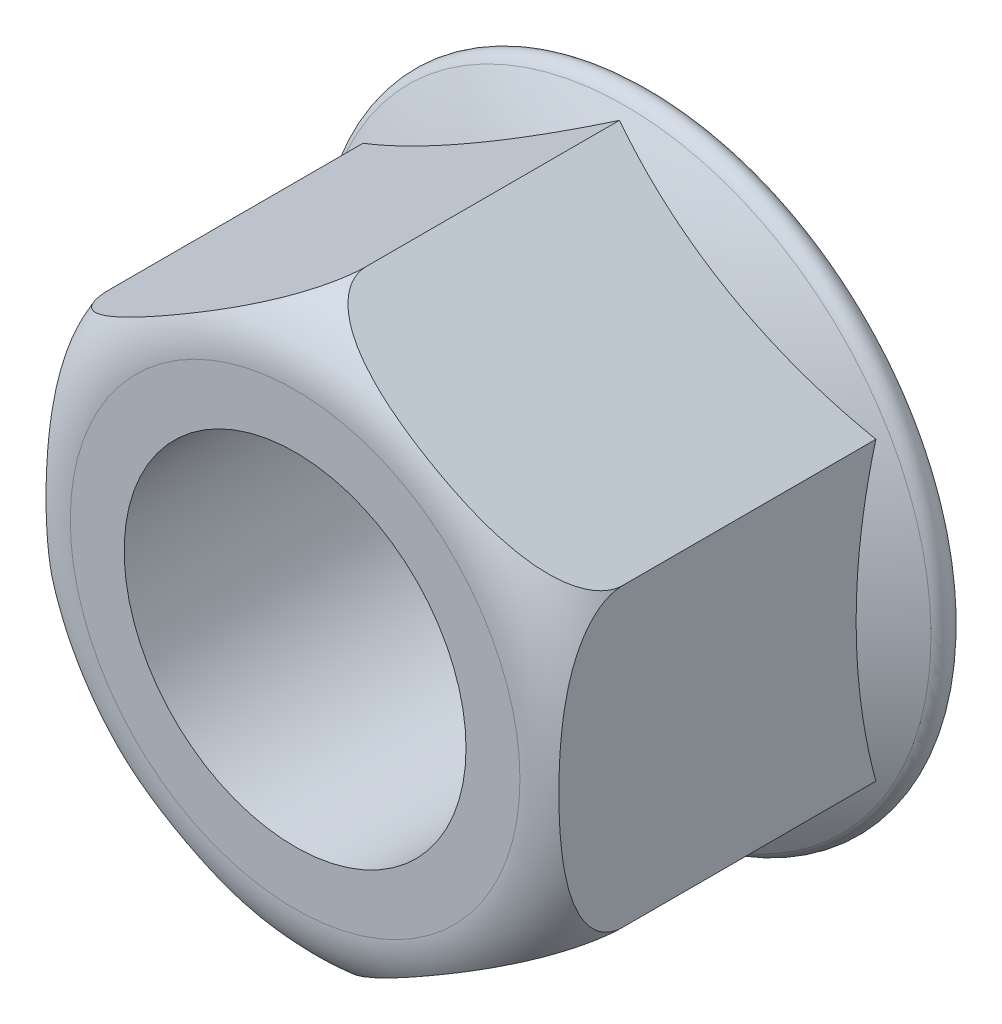
from build123d import *

# Parameters (mm, degrees)
HEAD_DEPTH         = 12.7
HOLE_SKETCH_R      = 6.096
THROUGH_HOLE_DEPTH = 21.266683312


with BuildPart() as part:
    # Head Sketch → Head (new body)
    with BuildSketch(Plane.XY):
        Polygon((0, 10.558581723), (9.144, 5.279290861), (9.144, -5.279290861), (0, -10.558581723), (-9.144, -5.279290861), (-9.144, 5.279290861), align=None)
    extrude(amount=HEAD_DEPTH)

    # Flange Sketch → Flange (revolve)
    with BuildSketch(Plane(origin=(0, 0, 0), x_dir=(-1, 0, 0), z_dir=(0, 1, 0)), mode=Mode.PRIVATE) as flange_sk:
        with BuildLine():
            Line((-10.668, 0), (0, 0))
            Line((0, 0), (0, 3.81))
            ThreePointArc((0, 3.81), (-5.643297007, 3.079227926), (-10.91431477, 0.935119563))
            ThreePointArc((-10.91431477, 0.935119563), (-11.151507901, 0.372641807), (-10.668, 0))
        make_face()
    revolve(flange_sk.sketch.rotate(Axis((0, 0, 1.843425858), (0, 0, 1)), 30), axis=Axis((0, 0, 1.843425858), (0, 0, 1)))

    # Sketch5 → Head Trim (revolve, cut)
    with BuildSketch(Plane(origin=(0, 0, 0), x_dir=(0, 0, -1), z_dir=(1, 0, 0)), mode=Mode.PRIVATE) as head_trim_sk:
        with BuildLine():
            Line((-12.7, -8.018581723), (-12.7, -10.558581723))
            Line((-12.7, -10.558581723), (-10.16, -10.558581723))
            ThreePointArc((-10.16, -10.558581723), (-11.956051224, -9.814632947), (-12.7, -8.018581723))
        make_face()
    revolve(head_trim_sk.sketch.rotate(Axis((0, 0, 15.085599173), (0, 0, -1)), 90), axis=Axis((0, 0, 15.085599173), (0, 0, -1)), mode=Mode.SUBTRACT)

    # Hole Sketch → Through Hole (cut, through all)
    with BuildSketch(Plane.XY.offset(12.7)):
        Circle(HOLE_SKETCH_R)
    extrude(amount=-THROUGH_HOLE_DEPTH, mode=Mode.SUBTRACT)


solid = part.part
